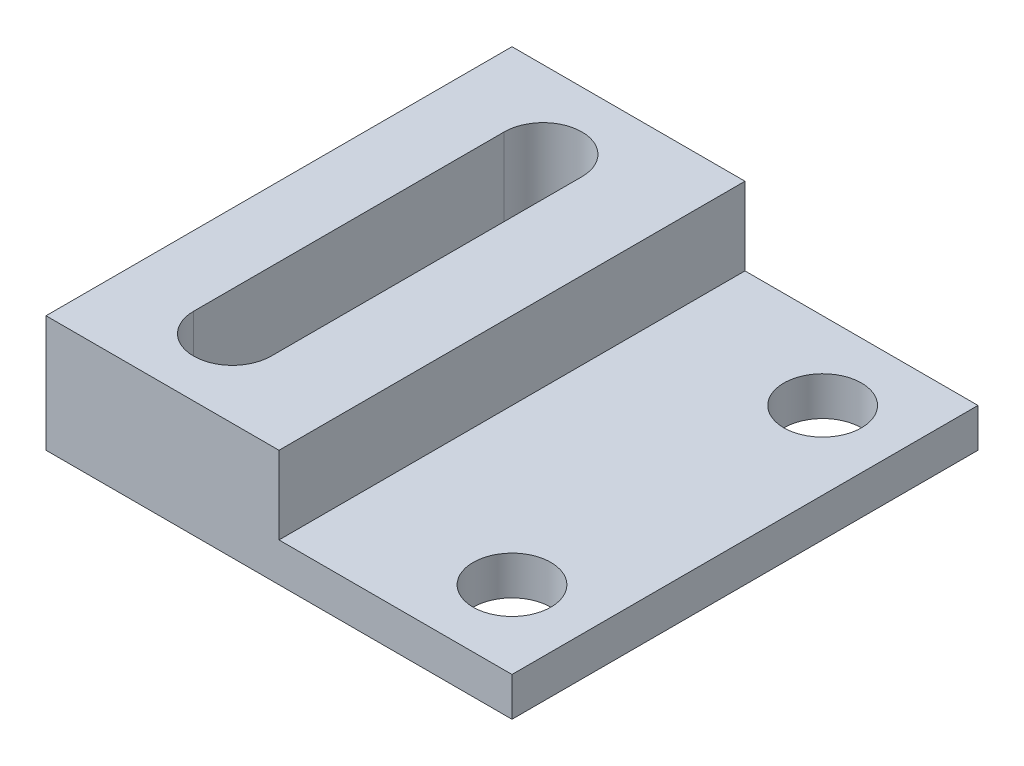
from build123d import *

# Parameters (mm, degrees)
SKETCH1_W                   = 38.1
SKETCH1_H                   = 9.525
BOSS_EXTRUDE1_DEPTH         = 19.05
SKETCH2_W                   = 19.05
SKETCH2_H                   = 6.35
CUT_EXTRUDE1_DEPTH          = 43.8625
F_1_4_0_25_DIAMETER_HOLE2_D = 6.35
CUT_EXTRUDE2_DEPTH          = 31.75


with BuildPart() as part:
    # Sketch1 → Boss-Extrude1 (new, symmetric)
    with BuildSketch(Plane.XY):
        Rectangle(SKETCH1_W, SKETCH1_H)
    extrude(amount=BOSS_EXTRUDE1_DEPTH, both=True)

    # Sketch2 → Cut-Extrude1 (cut, through all)
    with BuildSketch(Plane.XY.offset(19.05)):
        with Locations((9.525, 1.5875)):
            Rectangle(SKETCH2_W, SKETCH2_H)
    extrude(amount=-CUT_EXTRUDE1_DEPTH, mode=Mode.SUBTRACT)

    # 1/4 (0.25) Diameter Hole2 (through all)
    with Locations(Plane(origin=(0, -1.5875, 0), x_dir=(1, 0, 0), z_dir=(0, 1, 0))):
        with Locations((12.7, 12.7), (12.7, -12.7)):
            Hole(F_1_4_0_25_DIAMETER_HOLE2_D / 2)

    # Sketch11 → Cut-Extrude2 (cut)
    with BuildSketch(Plane(origin=(0, 4.7625, 0), x_dir=(1, 0, 0), z_dir=(0, 1, 0))):
        with BuildLine():
            Line((-13.335, -12.7), (-13.335, 12.7))
            ThreePointArc((-13.335, 12.7), (-10.16, 15.875), (-6.985, 12.7))
            Line((-6.985, 12.7), (-6.985, -12.7))
            ThreePointArc((-6.985, -12.7), (-10.16, -15.875), (-13.335, -12.7))
        make_face()
    extrude(amount=-CUT_EXTRUDE2_DEPTH, mode=Mode.SUBTRACT)


solid = part.part
